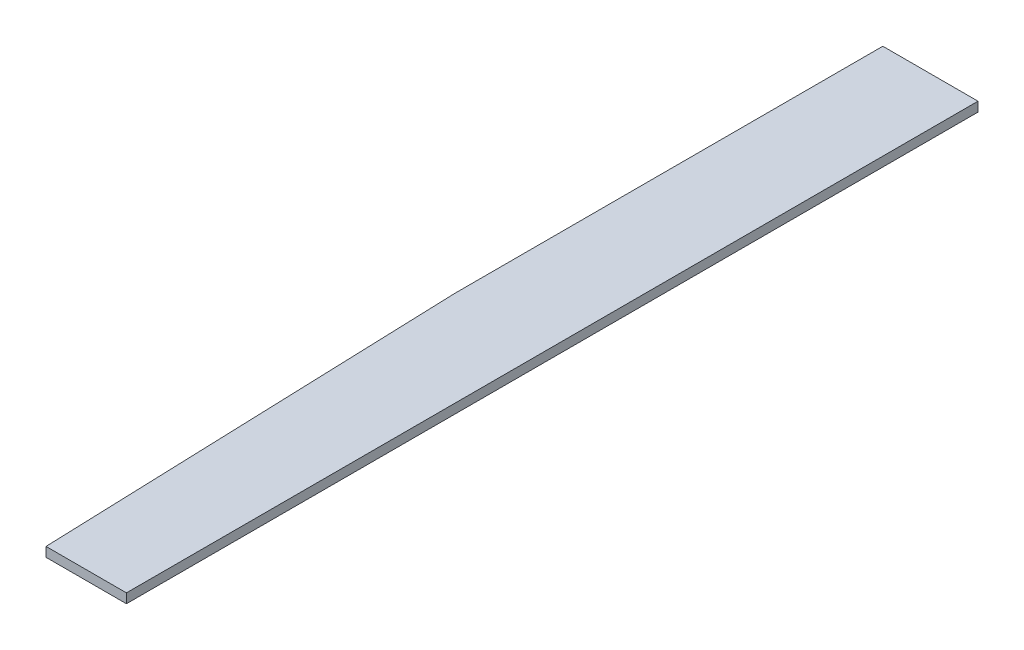
from build123d import *

# Parameters (mm, degrees)
BOSS_EXTRUDE1_DEPTH = 5


with BuildPart() as part:
    # Sketch1 → Boss-Extrude1 (new body)
    with BuildSketch(Plane(origin=(0, 0, 0), x_dir=(1, 0, 0), z_dir=(0, 1, 0))):
        Polygon((0, 0), (-42.5, 0), (-50.3, 223.782094102), (-50.3, 450), (0, 450), align=None)
    extrude(amount=BOSS_EXTRUDE1_DEPTH)


solid = part.part
